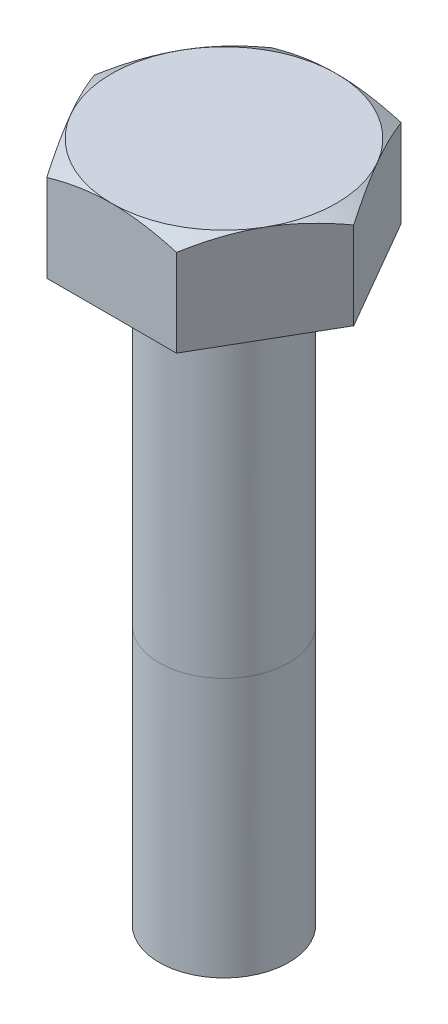
from build123d import *

# Parameters (mm, degrees)
BOSS_EXTRUDE1_DEPTH = 15
SKETCH2_R           = 10
BOSS_EXTRUDE2_DEPTH = 90
SKETCH3_OUTSIDE_W   = 444.08
SKETCH3_OUTSIDE_H   = 438.722
SKETCH3_OUTSIDE_R   = 17.320508076
CUT_EXTRUDE2_DEPTH  = 109.282039139
CUT_EXTRUDE2_DRAFT  = -60


with BuildPart() as part:
    # Sketch1 → Boss-Extrude1 (new body)
    with BuildSketch(Plane(origin=(0, 0, 0), x_dir=(1, 0, 0), z_dir=(0, 1, 0))):
        Polygon((10, -17.320508076), (20, 0), (10, 17.320508076), (-10, 17.320508076), (-20, 0), (-10, -17.320508076), align=None)
    extrude(amount=BOSS_EXTRUDE1_DEPTH)

    # Sketch2 → Boss-Extrude2 (add)
    with BuildSketch(Plane.XZ):
        with Locations(Location((0, 0, 0), (0, 0, 90))):
            Circle(SKETCH2_R)
    extrude(amount=BOSS_EXTRUDE2_DEPTH)


with BuildPart() as cut_extrude2_tool:
    # Sketch3 outside → Cut-Extrude2 (with draft: the straight prism first)
    with BuildSketch(Plane(origin=(0, 15, 0), x_dir=(1, 0, 0), z_dir=(0, 1, 0))):
        Rectangle(SKETCH3_OUTSIDE_W, SKETCH3_OUTSIDE_H)
        Circle(SKETCH3_OUTSIDE_R, mode=Mode.SUBTRACT)
    extrude(amount=-CUT_EXTRUDE2_DEPTH)
    # Cut-Extrude2: the draft: its side faces are tilted about the plane it starts from
    cut_extrude2_sides = [cut_extrude2_tool.faces().sort_by_distance(p)[0] for p in [
        (0, -39.641019569, 219.361),
        (222.04, -39.641019569, 0),
        (0, -39.641019569, -219.361),
        (-222.04, -39.641019569, 0),
        (-17.320508076, -39.641019569, 0),
    ]]
    draft(cut_extrude2_sides, Plane(origin=(0, 15, 0), x_dir=(1, 0, 0), z_dir=(0, 1, 0)), CUT_EXTRUDE2_DRAFT)


with BuildPart() as part_1:
    add(part.part)

    # Cut-Extrude2: cut by cut_extrude2_tool
    add(cut_extrude2_tool.part, mode=Mode.SUBTRACT)


solid = part_1.part
